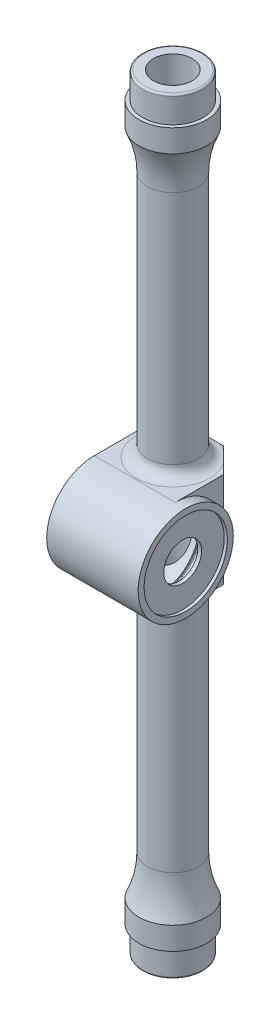
from build123d import *

# Parameters (mm, degrees)
BOSS_EXTRUDE1_DEPTH            = 17.018
BOSS_EXTRUDE2_DEPTH            = 21.412199999999995
BOSS_EXTRUDE2_DEPTH_BACK       = 17.018
SKETCH2_3_R                    = 20.002499999999998
RACK_CLEARANCE_HOLE_DEPTH      = 167.39531130741034
RACK_CLEARANCE_HOLE_DEPTH_BACK = 167.39531130741034
SKETCH5_R                      = 8.127999999999973
BODY_CHAMFER_DEPTH             = 25.4


with BuildPart() as part:
    # Sketch1 → Boss-Extrude1 (new, symmetric)
    with BuildSketch(Plane(origin=(0, 0, 0), x_dir=(0, 0, -1), z_dir=(1, 0, 0))):
        with BuildLine():
            ThreePointArc((4.000500000000006, -4.9e-15), (-1.8580966093160818, -14.143903390683924), (-16.002000000000002, -20.002500000000005))
            Line((-16.002, -20.0025), (14.731999999999996, -20.002499999999998))
            Line((14.731999999999996, -20.002499999999998), (14.731999999999996, 20.002499999999998))
            Line((14.731999999999996, 20.002499999999998), (-16.002, 20.0025))
            ThreePointArc((-16.002, 20.002500000000005), (-1.8580966093160782, 14.143903390683919), (4.000500000000006, 0))
        make_face()
    extrude(amount=BOSS_EXTRUDE1_DEPTH, both=True)

    # Sketch2<3> → Boss-Extrude2 (add, two sides: drawn at the far end of the back side and taken through both)
    with BuildSketch(Plane(origin=(0, 0, 0), x_dir=(0, 0, -1), z_dir=(1, 0, 0)).offset(-BOSS_EXTRUDE2_DEPTH_BACK)):
        with Locations((-16.001999999999995, -7.11e-15)):
            Circle(SKETCH2_3_R)
    extrude(amount=BOSS_EXTRUDE2_DEPTH + BOSS_EXTRUDE2_DEPTH_BACK)

    # Sketch4 → Rack Housing Revolve (revolve)
    with BuildSketch(Plane(origin=(0, 0, 0), x_dir=(0, 0, -1), z_dir=(1, 0, 0))):
        with BuildLine():
            Line((-8.127999999999954, -161.036), (-8.127999999999954, 161.036))
            Line((-8.127999999999954, 161.036), (-11.937999999999954, 161.036))
            ThreePointArc((-11.937999999999954, 161.036), (-12.476815367264102, 160.8128153672641), (-12.699999999999953, 160.27399999999997))
            Line((-12.699999999999953, 160.27399999999997), (-12.699999999999955, 149.92350000000002))
            Line((-12.699999999999955, 149.92350000000002), (-14.223999999999956, 149.92350000000002))
            Line((-14.223999999999956, 149.92350000000002), (-14.223999999999954, 140.3985))
            ThreePointArc((-14.223999999999954, 140.3985), (-11.56694213788461, 132.27408860688138), (-10.667999999999955, 123.77362273729518))
            Line((-10.667999999999955, 123.77362273729518), (-10.667999999999955, 24.765))
            ThreePointArc((-10.667999999999955, 24.765), (-12.062903954599022, 21.39740395459907), (-15.430499999999954, 20.0025))
            Line((-15.430499999999954, 20.0025), (-15.430499999999954, -20.0025))
            ThreePointArc((-15.430499999999954, -20.0025), (-12.062903954599022, -21.39740395459907), (-10.667999999999955, -24.765))
            Line((-10.667999999999955, -24.765), (-10.667999999999955, -123.77362273729518))
            ThreePointArc((-10.667999999999955, -123.77362273729518), (-11.56694213788461, -132.27408860688138), (-14.223999999999954, -140.3985))
            Line((-14.223999999999954, -140.3985), (-14.223999999999956, -149.92350000000002))
            Line((-14.223999999999956, -149.92350000000002), (-12.699999999999955, -149.92350000000002))
            Line((-12.699999999999955, -149.92350000000002), (-12.699999999999953, -160.27399999999997))
            ThreePointArc((-12.699999999999953, -160.27399999999997), (-12.476815367264102, -160.8128153672641), (-11.937999999999954, -161.036))
            Line((-11.937999999999954, -161.036), (-8.127999999999954, -161.036))
        make_face()
    revolve(axis=Axis((0, 220.98000000000002, 0), (0, -1, 0)))

    # Sketch2 → Pinion Revolve Cut (revolve, cut)
    with BuildSketch(Plane(origin=(0, 0, 0), x_dir=(1, 0, 0), z_dir=(0, 1, 0))):
        with BuildLine():
            Line((-17.018, -16.002000000000002), (-17.018, -26.67))
            Line((-17.018, -26.67), (-15.5448, -26.67))
            Line((-15.5448, -26.67), (-15.5448, -27.686000000000003))
            ThreePointArc((-15.5448, -27.686000000000003), (-15.451806403026724, -27.910506403026726), (-15.227300000000001, -28.003499999999995))
            Line((-15.227300000000001, -28.003499999999995), (-10.541, -28.0035))
            Line((-10.541, -28.0035), (-10.540999999999999, -32.4993))
            Line((-10.540999999999999, -32.4993), (10.540999999999999, -32.4993))
            Line((10.540999999999999, -32.4993), (10.541, -33.1851))
            ThreePointArc((10.541, -33.1851), (10.633993596973268, -33.40960640302673), (10.858499999999998, -33.5026))
            Line((10.858499999999998, -33.5026), (18.541999999999998, -33.502599999999994))
            Line((18.541999999999998, -33.502599999999994), (18.541999999999998, -23.9395))
            Line((18.541999999999998, -23.9395), (20.129499999999997, -23.9395))
            Line((20.129499999999997, -23.9395), (20.129499999999997, -33.502599999999994))
            Line((20.129499999999997, -33.502599999999994), (21.412199999999995, -33.502599999999994))
            Line((21.412199999999995, -33.502599999999994), (21.412199999999995, -16.002))
            Line((21.412199999999995, -16.002), (-17.018, -16.002000000000002))
        make_face()
    revolve(axis=Axis((-17.018, 0, 16.002000000000002), (1, 0, -9e-17)), mode=Mode.SUBTRACT)

    # Sketch5 → Rack Clearance Hole (cut, two sides: drawn at the far end of the back side and taken through both)
    with BuildSketch(Plane(origin=(0, 0, 0), x_dir=(1, 0, 0), z_dir=(0, 1, 0)).offset(-RACK_CLEARANCE_HOLE_DEPTH_BACK)):
        Circle(SKETCH5_R)
    extrude(amount=RACK_CLEARANCE_HOLE_DEPTH + RACK_CLEARANCE_HOLE_DEPTH_BACK, mode=Mode.SUBTRACT)

    # Sketch6 → Body Chamfer (cut, symmetric)
    with BuildSketch(Plane(origin=(0, 0, 0), x_dir=(1, 0, 0), z_dir=(0, 1, 0))):
        Polygon((-6.603999999999999, 14.731999999999996), (6.603999999999999, 14.731999999999996), (17.018, 4.318000000000113), (17.018, 14.731999999999996), (17.018, 17.906999999999996), (-17.018, 17.906999999999996), (-17.018, 14.731999999999996), (-17.018, 4.318000000000103), align=None)
    extrude(amount=BODY_CHAMFER_DEPTH, both=True, mode=Mode.SUBTRACT)


solid = part.part
